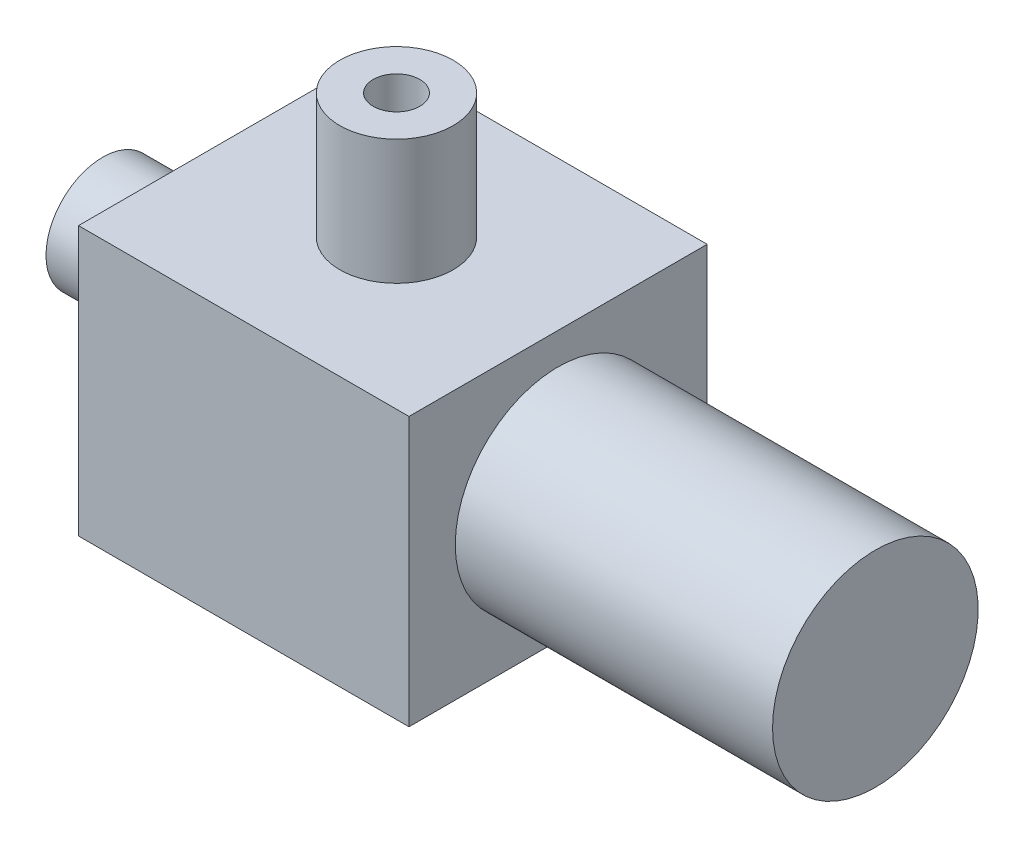
from build123d import *

# Parameters (mm, degrees)
BODY_SKETCH_W          = 45
BODY_SKETCH_H          = 36.6
BODY_DEPTH             = 20.3
INLET_SKETCH_W         = 17
INLET_SKETCH_H         = 7.722
SPRING_CAP_SKETCH_W    = 43.2
SPRING_CAP_SKETCH_H    = 14
OUTLET_SKETCH_W        = 7.722
OUTLET_SKETCH_H        = 17
INLET_SOCKET_SKETCH_W  = 16.2
INLET_SOCKET_SKETCH_H  = 3.175
OUTLET_SOCKET_SKETCH_W = 3.175
OUTLET_SOCKET_SKETCH_H = 16.2


with BuildPart() as part:
    # Body Sketch → Body (new, symmetric)
    with BuildSketch(Plane.XY):
        with Locations((39.5, 0)):
            Rectangle(BODY_SKETCH_W, BODY_SKETCH_H)
    extrude(amount=BODY_DEPTH, both=True)

    # Inlet Sketch → Inlet (revolve)
    with BuildSketch(Plane.XY):
        with Locations((8.5, 3.861)):
            Rectangle(INLET_SKETCH_W, INLET_SKETCH_H)
    revolve(axis=Axis((-1000, 0, 0), (1, 0, 0)))

    # Spring Cap Sketch → Spring Cap (revolve)
    with BuildSketch(Plane.XY):
        with Locations((83.6, 7)):
            Rectangle(SPRING_CAP_SKETCH_W, SPRING_CAP_SKETCH_H)
    revolve(axis=Axis((-1000, 0, 0), (1, 0, 0)))

    # Outlet Sketch → Outlet (revolve)
    with BuildSketch(Plane.XY):
        with Locations((43.861, 26.8)):
            Rectangle(OUTLET_SKETCH_W, OUTLET_SKETCH_H)
    revolve(axis=Axis((40, 0, 0), (0, 1, 0)))

    # Inlet Socket Sketch → Inlet Socket (revolve, cut)
    with BuildSketch(Plane.XY):
        with Locations((7.1, 1.5875)):
            Rectangle(INLET_SOCKET_SKETCH_W, INLET_SOCKET_SKETCH_H)
    revolve(axis=Axis((-1000, 0, 0), (1, 0, 0)), mode=Mode.SUBTRACT)

    # Outlet Socket Sketch → Outlet Socket (revolve, cut)
    with BuildSketch(Plane.XY):
        with Locations((41.5875, 28.2)):
            Rectangle(OUTLET_SOCKET_SKETCH_W, OUTLET_SOCKET_SKETCH_H)
    revolve(axis=Axis((40, 0, 0), (0, 1, 0)), mode=Mode.SUBTRACT)


solid = part.part
